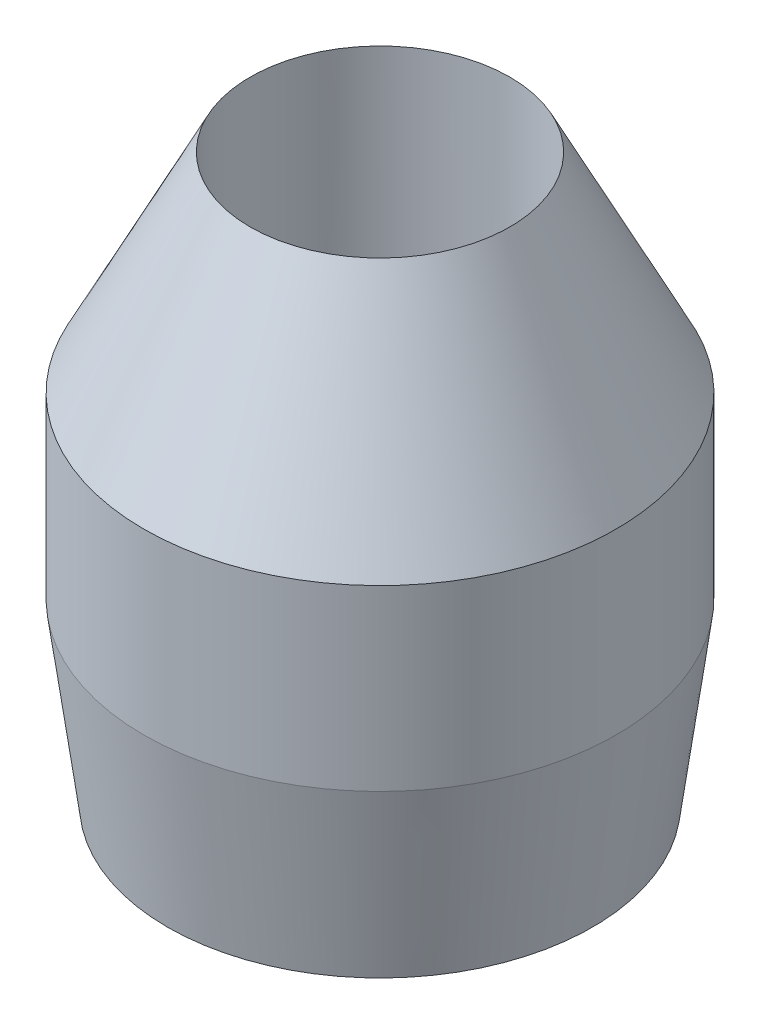
from build123d import *

# Parameters (mm, degrees)
SKETCH1_R           = 10
BOSS_EXTRUDE1_DEPTH = 15.1
SKETCH2_R           = 8.25
CUT_EXTRUDE1_DEPTH  = 7
SKETCH3_R           = 6.35
CUT_EXTRUDE2_DEPTH  = 8.1
SKETCH7_R           = 10
BOSS_EXTRUDE2_DEPTH = 10
BOSS_EXTRUDE2_TAPER = 27
SKETCH8_R           = 5.5
CUT_EXTRUDE3_DEPTH  = 10


with BuildPart() as part:
    # Sketch1 → Boss-Extrude1 (new body)
    with BuildSketch(Plane(origin=(0, 0, 0), x_dir=(1, 0, 0), z_dir=(0, 1, 0))):
        with Locations(Location((0, 0, 0), (0, 0, 270))):
            Circle(SKETCH1_R)
    extrude(amount=BOSS_EXTRUDE1_DEPTH)

    # Sketch2 → Cut-Extrude1 (cut)
    with BuildSketch(Plane(origin=(0, 0, 0), x_dir=(-1, 0, 0), z_dir=(0, -1, 0))):
        with Locations(Location((0, 0, 0), (0, 0, 90))):
            Circle(SKETCH2_R)
    extrude(amount=-CUT_EXTRUDE1_DEPTH, mode=Mode.SUBTRACT)

    # Sketch3 → Cut-Extrude2 (cut)
    with BuildSketch(Plane.XZ.offset(-7)):
        with Locations(Location((0, 0, 0), (0, 0, 270))):
            Circle(SKETCH3_R)
    extrude(amount=-CUT_EXTRUDE2_DEPTH, mode=Mode.SUBTRACT)

    # Sketch7 → Boss-Extrude2 (add)
    with BuildSketch(Plane(origin=(0, 15.1, 0), x_dir=(1, 0, 0), z_dir=(0, 1, 0))):
        with Locations(Location((0, 0, 0), (0, 0, 270))):
            Circle(SKETCH7_R)
    extrude(amount=BOSS_EXTRUDE2_DEPTH, taper=BOSS_EXTRUDE2_TAPER)

    # Sketch8 → Cut-Extrude3 (cut)
    with BuildSketch(Plane(origin=(0, 25.1, 0), x_dir=(1, 0, 0), z_dir=(0, 1, 0))):
        with Locations(Location((0, 0, 0), (0, 0, 270))):
            Circle(SKETCH8_R)
    extrude(amount=-CUT_EXTRUDE3_DEPTH, mode=Mode.SUBTRACT)

    # Sketch9 → Cut-Revolve1 (revolve, cut)
    with BuildSketch(Plane.XY, mode=Mode.PRIVATE) as cut_revolve1_sk:
        Polygon((10, 0), (10, 7.55), (9, 0), align=None)
    revolve(cut_revolve1_sk.sketch.rotate(Axis((0, -5.35411367, 0), (0, 1, 0)), 90), axis=Axis((0, -5.35411367, 0), (0, 1, 0)), mode=Mode.SUBTRACT)


solid = part.part
